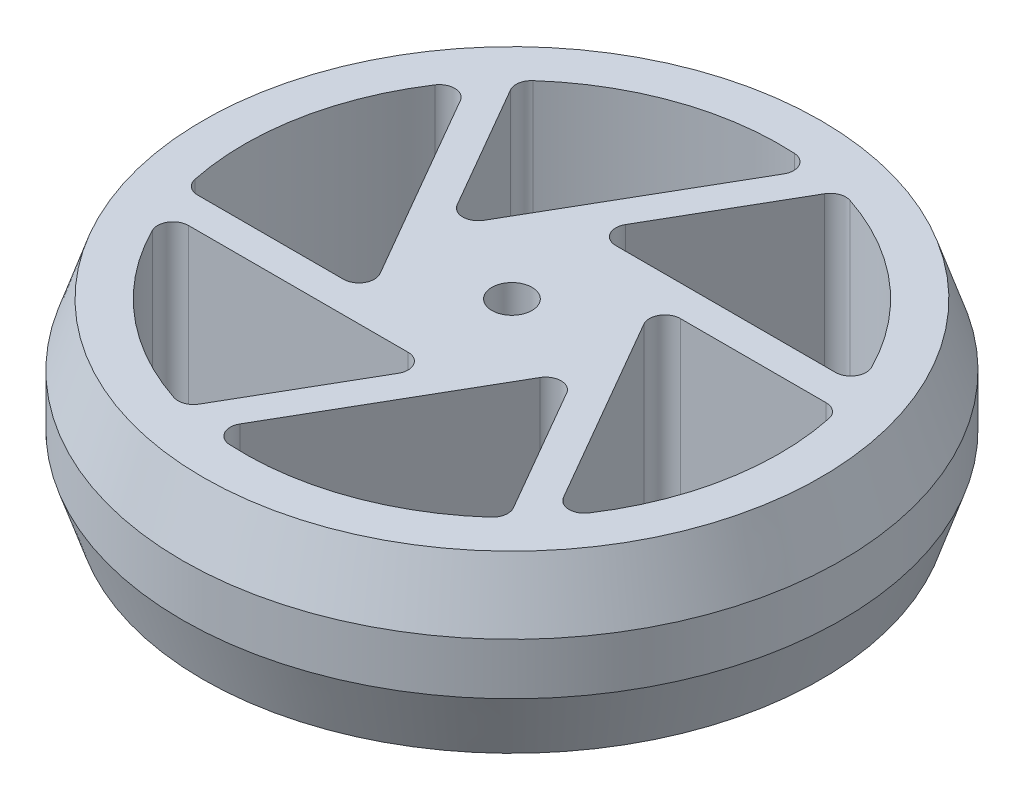
from build123d import *

# Parameters (mm, degrees)
CUT_EXTRUDE1_REACH             = 48.046
CUT_EXTRUDE1_DIRECTION_2_REACH = 48.046
CIRPATTERN1_COUNT              = 6
CUT_EXTRUDE2_DEPTH             = 15
CUT_EXTRUDE2_DEPTH_BACK        = 15
SKETCH6_R                      = 1.95


with BuildPart() as part:
    # Sketch2 → Revolve1 (revolve)
    with BuildSketch(Plane.XY, mode=Mode.PRIVATE) as revolve1_sk:
        Polygon((0, 0), (32, 0), (32, 2.5), (30, 8.5), (0, 8.5), align=None)
    revolve1 = revolve(revolve1_sk.sketch.rotate(Axis((0, 8.5, 0), (0, -1, 0)), 90), axis=Axis((0, 8.5, 0), (0, -1, 0)))

    # Mirror1: Revolve1 across plane
    add(revolve1.mirror(Plane.ZX))

    # Cut-Extrude1: up to this face of the body (flat: up to its plane)
    cut_extrude1_end = Plane(part.part.faces().sort_by_distance((0, 8.5, 0))[0])
    # Sketch3 → Cut-Extrude1 (cut, up to the picked face)
    with BuildSketch(Plane(origin=(0, 0, 0), x_dir=(1, 0, 0), z_dir=(0, 1, 0)), mode=Mode.PRIVATE) as cut_extrude1_sk1:
        with BuildLine():
            Line((0.562177826, 9.526279442), (5.5, 9.526279442))
            Line((5.5, 9.526279442), (21.878554835, 9.526279442))
            ThreePointArc((21.878554835, 9.526279442), (23.155781812, 10.23971015), (23.218058192, 11.701357775))
            ThreePointArc((23.218058192, 11.701357775), (16.957041557, 19.709356703), (8.104096566, 24.704728674))
            ThreePointArc((8.104096566, 24.704728674), (7.100974397, 24.680582577), (6.337514428, 24.029455866))
            Line((6.337514428, 24.029455866), (-0.736860279, 11.776279442))
            ThreePointArc((-0.736860279, 11.776279442), (-0.736860279, 10.276279442), (0.562177826, 9.526279442))
        make_face()
    cut_extrude1_tool1 = split(extrude(cut_extrude1_sk1.sketch, amount=CUT_EXTRUDE1_REACH, mode=Mode.PRIVATE), bisect_by=cut_extrude1_end, keep=Keep.BOTH, mode=Mode.PRIVATE)
    cut_extrude1 = cut_extrude1_tool1.solids().sort_by(Axis((10.856856, 0, -15.344995), (0, 1, 0)))[0]
    add(cut_extrude1, mode=Mode.SUBTRACT)

    # Cut-Extrude1 direction 2: up to this face of the body (flat: up to its plane)
    cut_extrude1_direction_2_end = Plane(part.part.faces().sort_by_distance((0, -8.5, 0))[0])
    # Sketch3 → Cut-Extrude1 direction 2 (cut, up to the picked face)
    with BuildSketch(Plane(origin=(0, 0, 0), x_dir=(1, 0, 0), z_dir=(0, 1, 0)), mode=Mode.PRIVATE) as cut_extrude1_direction_2_sk1:
        with BuildLine():
            Line((0.562177826, 9.526279442), (5.5, 9.526279442))
            Line((5.5, 9.526279442), (21.878554835, 9.526279442))
            ThreePointArc((21.878554835, 9.526279442), (23.155781812, 10.23971015), (23.218058192, 11.701357775))
            ThreePointArc((23.218058192, 11.701357775), (16.957041557, 19.709356703), (8.104096566, 24.704728674))
            ThreePointArc((8.104096566, 24.704728674), (7.100974397, 24.680582577), (6.337514428, 24.029455866))
            Line((6.337514428, 24.029455866), (-0.736860279, 11.776279442))
            ThreePointArc((-0.736860279, 11.776279442), (-0.736860279, 10.276279442), (0.562177826, 9.526279442))
        make_face()
    cut_extrude1_direction_2_tool1 = split(extrude(cut_extrude1_direction_2_sk1.sketch, amount=-CUT_EXTRUDE1_DIRECTION_2_REACH, mode=Mode.PRIVATE), bisect_by=cut_extrude1_direction_2_end, keep=Keep.BOTH, mode=Mode.PRIVATE)
    cut_extrude1_direction_2 = cut_extrude1_direction_2_tool1.solids().sort_by(Axis((10.856856, 0, -15.344995), (0, -1, 0)))[0]
    add(cut_extrude1_direction_2, mode=Mode.SUBTRACT)

    # CirPattern1: Cut-Extrude1, Cut-Extrude1 direction 2 ×6 about axis
    cirpattern1_axis = Axis((0, 0, 0), (0, 1, 0))
    add([cut_extrude1.rotate(cirpattern1_axis, i * 360 / CIRPATTERN1_COUNT) for i in range(1, CIRPATTERN1_COUNT)], mode=Mode.SUBTRACT)
    add([cut_extrude1_direction_2.rotate(cirpattern1_axis, i * 360 / CIRPATTERN1_COUNT) for i in range(1, CIRPATTERN1_COUNT)], mode=Mode.SUBTRACT)

    # Sketch6 → Cut-Extrude2 (cut, two sides: drawn at the far end of the back side and taken through both)
    with BuildSketch(Plane(origin=(0, 0, 0), x_dir=(1, 0, 0), z_dir=(0, 1, 0)).offset(-CUT_EXTRUDE2_DEPTH_BACK)):
        with Locations(Location((0, 0, 0), (0, 0, 270))):
            Circle(SKETCH6_R)
    extrude(amount=CUT_EXTRUDE2_DEPTH + CUT_EXTRUDE2_DEPTH_BACK, mode=Mode.SUBTRACT)


solid = part.part
